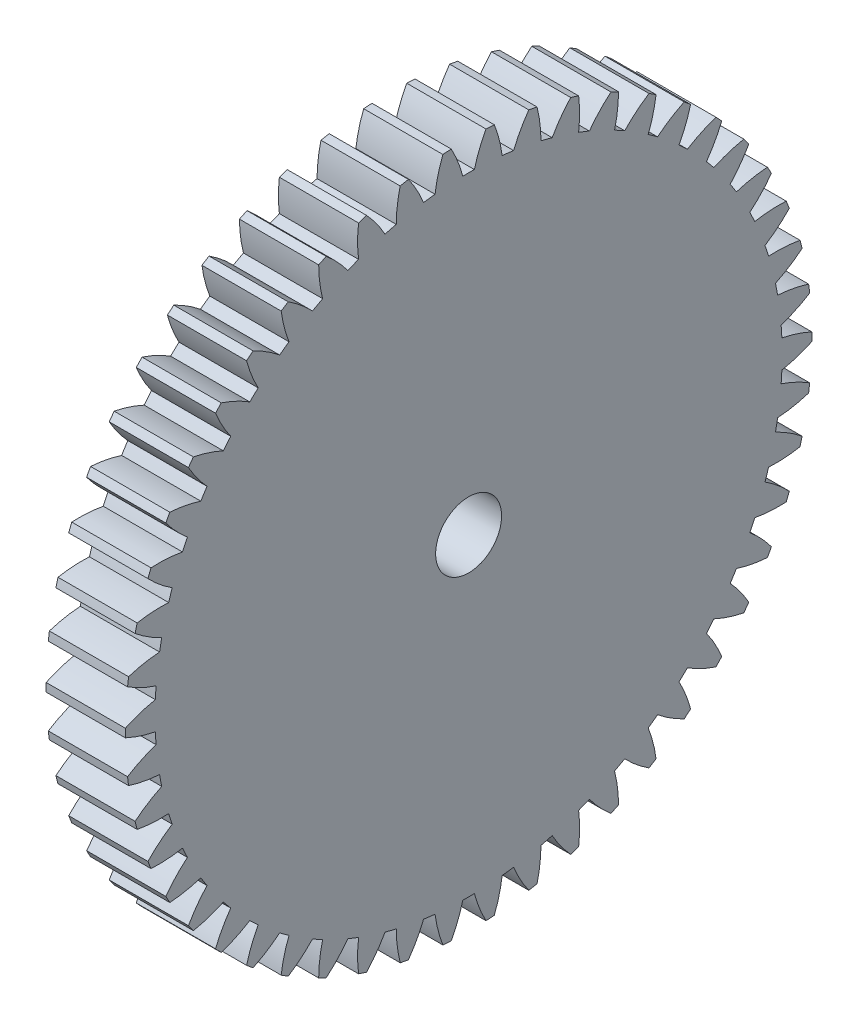
from build123d import *

# Parameters (mm, degrees)
BASPROSKE_W     = 6
BASPROSKE_H     = 26
TOOTHCUT_DEPTH  = 38.25587202
TEETHCUTS_COUNT = 50
TEETHCUTS_ANGLE = 352.8
BORSKE_R        = 2.5
BORE_DEPTH      = 50.0000508


with BuildPart() as part:
    # BasProSke → Base-Revolve (revolve)
    with BuildSketch(Plane(origin=(0, 0, 0), x_dir=(1, 0, 0), z_dir=(0, 1, 0)), mode=Mode.PRIVATE) as base_revolve_sk:
        with Locations((3, 13)):
            Rectangle(BASPROSKE_W, BASPROSKE_H)
    revolve(base_revolve_sk.sketch.rotate(Axis((-10, 0, 0), (1, 0, 0)), 180), axis=Axis((-10, 0, 0), (1, 0, 0)))

    # TooCutSke → ToothCut (cut, through all)
    with BuildSketch(Plane(origin=(0, 0, 0), x_dir=(0, 0, -1), z_dir=(1, 0, 0))):
        with BuildLine():
            ThreePointArc((0.437663408, 23.744966872), (0, 23.749), (-0.437663408, 23.744966872))
            ThreePointArc((-0.437663408, 23.744966872), (-0.815428123, 24.895236298), (-1.329433358, 25.991422664))
            ThreePointArc((-1.329433358, 25.991422664), (0, 26.0254), (1.329433358, 25.991422664))
            ThreePointArc((1.329433358, 25.991422664), (0.815428123, 24.895236298), (0.437663408, 23.744966872))
        make_face()
    toothcut = extrude(amount=TOOTHCUT_DEPTH, mode=Mode.SUBTRACT)

    # TeethCuts: ToothCut ×50 about axis
    teethcuts_axis = Axis((-10, 0, 0), (1, 0, 0))
    for i in range(1, TEETHCUTS_COUNT):
        add(toothcut.rotate(teethcuts_axis, i * TEETHCUTS_ANGLE / (TEETHCUTS_COUNT - 1)), mode=Mode.SUBTRACT)

    # BorSke → Bore (cut, symmetric)
    with BuildSketch(Plane(origin=(0, 0, 0), x_dir=(0, 0, -1), z_dir=(1, 0, 0))):
        with Locations(Location((0, 0, 0), (0, 0, 180))):
            Circle(BORSKE_R)
    extrude(amount=BORE_DEPTH, both=True, mode=Mode.SUBTRACT)


solid = part.part
